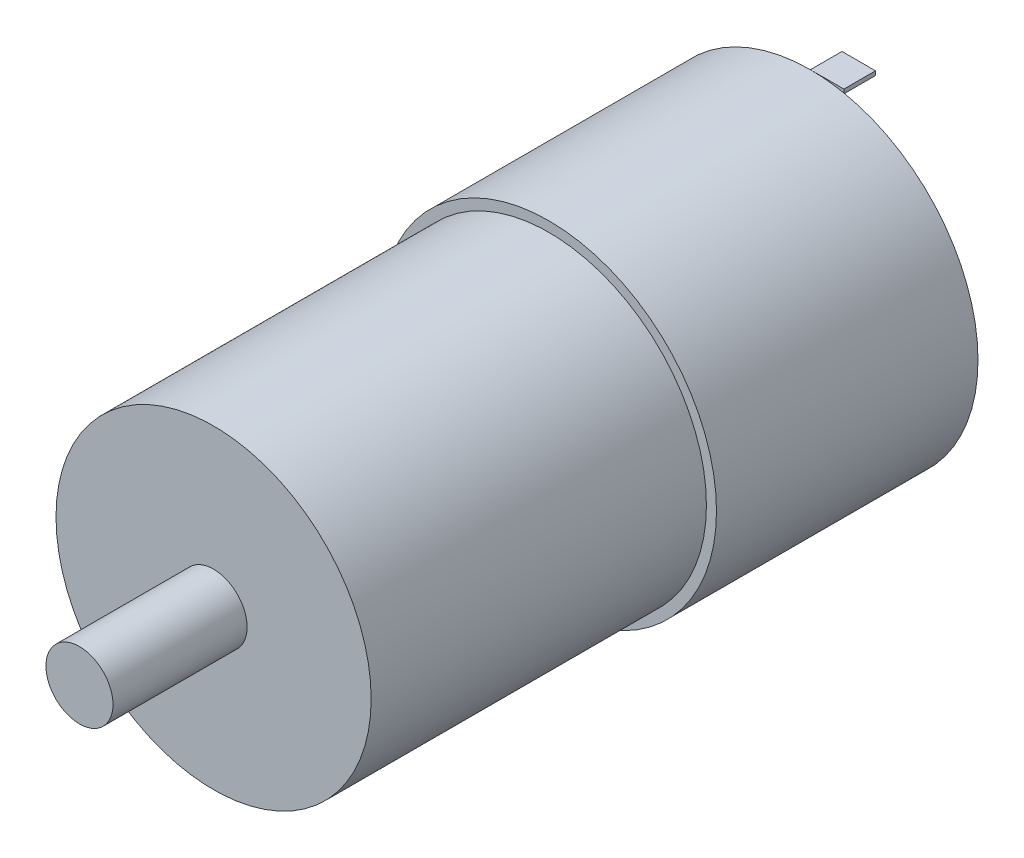
from build123d import *

# Parameters (mm, degrees)
SKETCH1_R           = 25
BOSS_EXTRUDE1_DEPTH = 39
SKETCH2_R           = 23.5
BOSS_EXTRUDE2_DEPTH = 50
SKETCH3_R           = 5
BOSS_EXTRUDE3_DEPTH = 20
SKETCH4_W           = 4.717886869
SKETCH4_H           = 0.61518364
SKETCH4_H_2         = 1.339282812
BOSS_EXTRUDE4_DEPTH = 5


with BuildPart() as part:
    # Sketch1 → Boss-Extrude1 (new body)
    with BuildSketch(Plane.XY):
        Circle(SKETCH1_R)
    extrude(amount=BOSS_EXTRUDE1_DEPTH)

    # Sketch2 → Boss-Extrude2 (add)
    with BuildSketch(Plane.XY.offset(39)):
        Circle(SKETCH2_R)
    extrude(amount=BOSS_EXTRUDE2_DEPTH)

    # Sketch3 → Boss-Extrude3 (add)
    with BuildSketch(Plane.XY.offset(89)):
        Circle(SKETCH3_R)
    extrude(amount=BOSS_EXTRUDE3_DEPTH)

    # Sketch4 → Boss-Extrude4 (add)
    with BuildSketch(Plane(origin=(0, 0, 0), x_dir=(0, 0, -1), z_dir=(1, 0, 0))):
        with Locations((2.358943434, 24.69240818)):
            Rectangle(SKETCH4_W, SKETCH4_H)
        with Locations((2.358943434, -24.848693341)):
            Rectangle(SKETCH4_W, SKETCH4_H_2)
    extrude(amount=BOSS_EXTRUDE4_DEPTH)


solid = part.part
